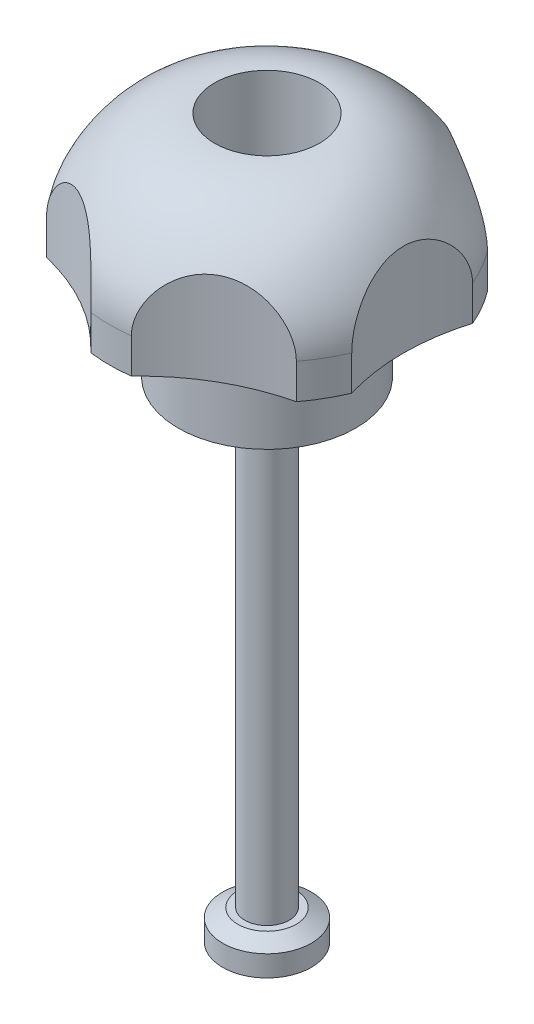
from build123d import *

# Parameters (mm, degrees)
CORTAR_EXTRUIR1_DEPTH = 89.610326763


with BuildPart() as part:
    # Croquis2 → Revolución1 (revolve)
    with BuildSketch(Plane.XY):
        with BuildLine():
            Line((3.175, 70), (12.7, 70))
            Line((12.7, 70), (12.7, 87.7))
            add(Edge.make_bspline(
                [(12.7, 87.7), (18.502741551, 87.7), (18.502741551, 82.7)],
                knots=[0, 0, 0, 1, 1, 1], degree=2))
            Line((18.502741551, 82.7), (22.5, 82.7))
            Line((22.5, 82.7), (22.5, 87.7))
            add(Edge.make_bspline(
                [(7.5, 102.7), (13.042740157, 102.7), (19.451979538, 97.810764177), (22.5, 90.380625461), (22.5, 87.7)],
                knots=[0, 0, 0, 0, 0.655380699, 1, 1, 1, 1], degree=3))
            Line((7.5, 102.7), (7.5, 90))
            Line((7.5, 90), (0, 90))
            Line((0, 90), (0, 0))
            Line((0, 0), (6.35, 0))
            Line((6.35, 0), (6.35, 3))
            Line((6.35, 3), (4.175, 4.255736835))
            Line((4.175, 4.255736835), (3.175, 4.255736835))
            Line((3.175, 4.255736835), (3.175, 70))
        make_face()
    revolve(axis=Axis((0, 0, 0), (0, 1, 0)))

    # Croquis3 → Cortar-Extruir1 (cut, through all)
    with BuildSketch(Plane.XZ.offset(-82.7)):
        with BuildLine():
            ThreePointArc((20.772727273, 8.645449766), (19.5, 0), (20.772727273, -8.645449766))
            ThreePointArc((20.772727273, -8.645449766), (22.5, 0), (20.772727273, 8.645449766))
        make_face()
        with BuildLine():
            ThreePointArc((17.873542761, -13.666984641), (9.75, -16.887495374), (2.899184512, -22.312434407))
            ThreePointArc((2.899184512, -22.312434407), (11.25, -19.485571585), (17.873542761, -13.666984641))
        make_face()
        with BuildLine():
            ThreePointArc((-2.899184512, -22.312434407), (-9.75, -16.887495374), (-17.873542761, -13.666984641))
            ThreePointArc((-17.873542761, -13.666984641), (-11.25, -19.485571585), (-2.899184512, -22.312434407))
        make_face()
        with BuildLine():
            ThreePointArc((-20.772727273, -8.645449766), (-19.5, 0), (-20.772727273, 8.645449766))
            ThreePointArc((-20.772727273, 8.645449766), (-22.5, 0), (-20.772727273, -8.645449766))
        make_face()
        with BuildLine():
            ThreePointArc((-17.873542761, 13.666984641), (-9.75, 16.887495374), (-2.899184512, 22.312434407))
            ThreePointArc((-2.899184512, 22.312434407), (-11.25, 19.485571585), (-17.873542761, 13.666984641))
        make_face()
        with BuildLine():
            ThreePointArc((2.899184512, 22.312434407), (9.75, 16.887495374), (17.873542761, 13.666984641))
            ThreePointArc((17.873542761, 13.666984641), (11.25, 19.485571585), (2.899184512, 22.312434407))
        make_face()
    extrude(amount=-CORTAR_EXTRUIR1_DEPTH, mode=Mode.SUBTRACT)


solid = part.part
